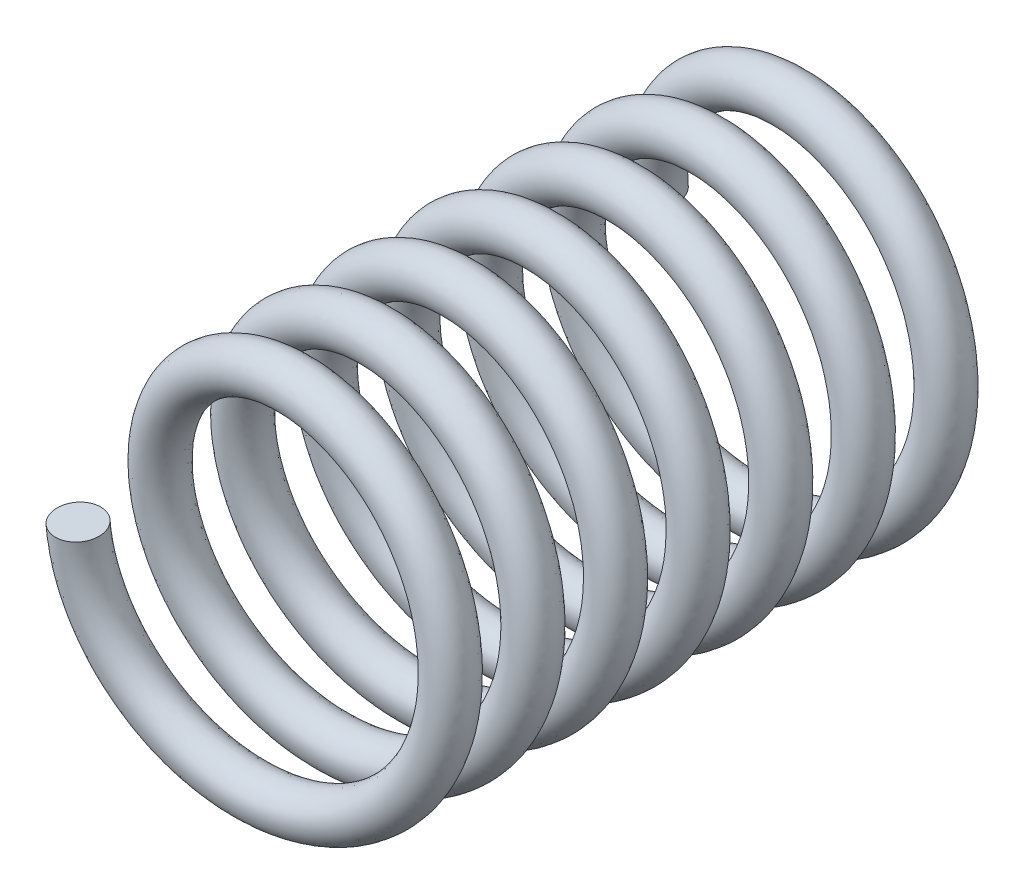
from build123d import *

# Parameters (mm, degrees)
S_P_R1_PITCH       = 5
S_P_R1_HEIGHT      = 35
S_P_R1_RADIUS      = 10
S_P_R1_START_ANGLE = -180
IZIM2_R            = 1.375


with BuildPart() as part:
    # Süpür1: sweep along a helix
    with BuildLine() as s_p_r1_path:
        add(Helix(S_P_R1_PITCH, S_P_R1_HEIGHT, S_P_R1_RADIUS, center=(0, 0, 0), direction=(0, 0, 1), lefthand=True, mode=Mode.PRIVATE).rotate(Axis((0, 0, 0), (0, 0, 1)), S_P_R1_START_ANGLE))
    # Çizim2 → Süpür1 (sweep)
    with BuildSketch(Plane(origin=(-10, 0, 35), x_dir=(0.2645985827188338, 0.07649938562697271, -0.9613196315595975), z_dir=(8.907111159750512e-14, 0.996848672150329, 0.07932669684366017))):
        Circle(IZIM2_R)
    sweep(path=s_p_r1_path.line, is_frenet=True)


solid = part.part
